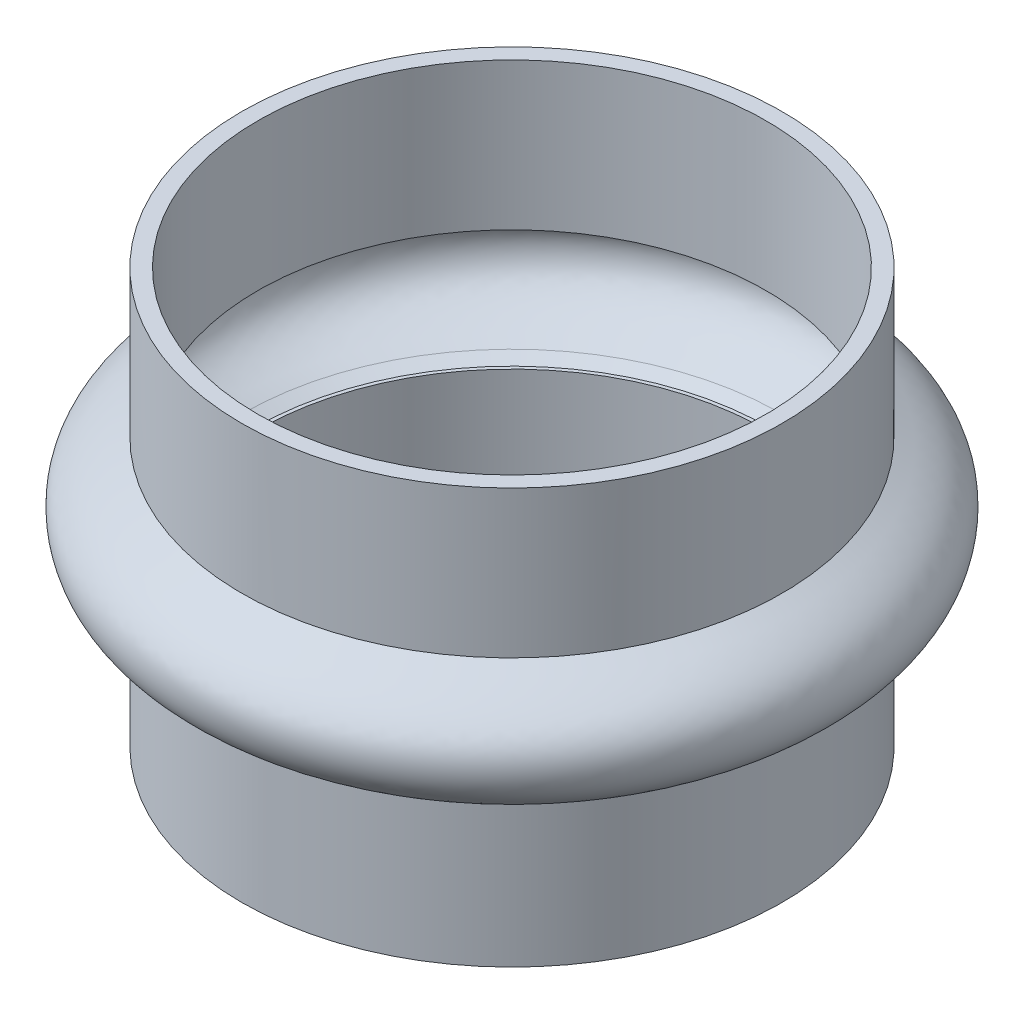
from build123d import *

# Parameters (mm, degrees)
SKETCH2_R           = 18.365
SKETCH2_R_2         = 17.279321286
BOSS_EXTRUDE1_DEPTH = 10


with BuildPart() as part:
    # Sketch1 → Revolve1 (revolve)
    with BuildSketch(Plane.XY):
        with BuildLine():
            Line((7.325278854, 63.411883954), (8.410957568, 63.411883954))
            Line((8.410957568, 63.411883954), (7.555549556, 62.968064842))
            add(Edge.make_bspline(
                [(7.555549556, 62.968064842), (7.34999991, 62.861417651), (6.947144673, 62.660387479), (6.05410487, 62.201842629), (4.95450234, 61.540590874), (4.15954484, 60.725704583), (3.843595581, 60.013758398), (3.734630504, 59.178179351), (3.989989442, 58.064696871), (4.831837818, 57.106551686), (6.08596344, 56.311379341), (6.949277865, 55.883126275), (7.373486281, 55.648841265)],
                knots=[0, 0, 0, 0, 0.0625, 0.125, 0.25, 0.375, 0.4375, 0.5, 0.625, 0.75, 0.875, 1, 1, 1, 1], degree=3))
            Line((7.373486281, 55.648841265), (8.165980219, 55.21115676))
            Line((8.165980219, 55.21115676), (7.131758595, 55.21115676))
            add(Edge.make_bspline(
                [(7.325278854, 63.411883954), (6.011135244, 62.730054884), (2.971783405, 61.4251647), (3.46335157, 56.912604996), (5.942640085, 55.867892063), (7.131758595, 55.21115676)],
                knots=[0, 0, 0, 0, 0.430000258, 0.624673055, 1, 1, 1, 1], degree=3))
        make_face()
    revolve(axis=Axis((25.690278854, 76.539342874, 0), (0, -1, 0)))

    # Sketch2 → Boss-Extrude1 (add)
    with BuildSketch(Plane(origin=(0, 63.411883954, 0), x_dir=(1, 0, 0), z_dir=(0, 1, 0))):
        with Locations(Location((25.690278854, 0, 0), (0, 0, 180))):
            Circle(SKETCH2_R)
        with Locations(Location((25.690278854, 0, 0), (0, 0, 270))):
            Circle(SKETCH2_R_2, mode=Mode.SUBTRACT)
    boss_extrude1 = extrude(amount=BOSS_EXTRUDE1_DEPTH)

    # Mirror1: Boss-Extrude1 across plane
    add(boss_extrude1.mirror(Plane.ZX.offset(59.311520357)))


solid = part.part
